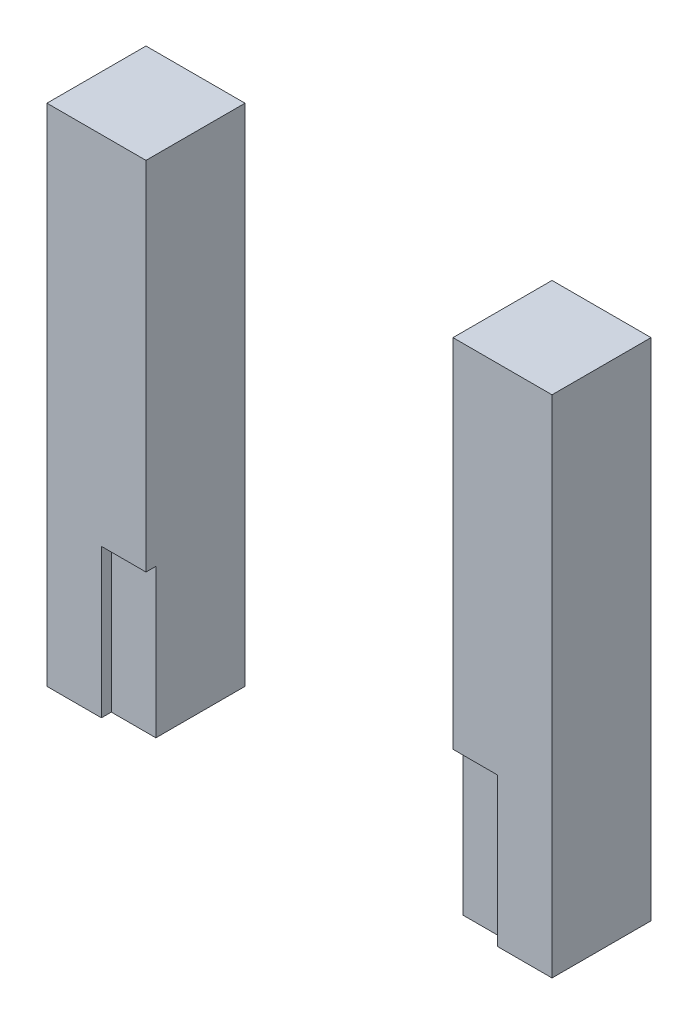
from build123d import *

# Parameters (mm, degrees)
SKETCH1_W           = 510
SKETCH1_H           = 510
SKETCH1_W_2         = 310
SKETCH1_H_2         = 310
BOSS_EXTRUDE1_DEPTH = 50
SKETCH2_W           = 400
SKETCH2_H           = 150
CUT_EXTRUDE1_DEPTH  = 10
SKETCH3_W           = 310
SKETCH3_H           = 100
CUT_EXTRUDE2_DEPTH  = 375.232548023


with BuildPart() as part:
    # Sketch1 → Boss-Extrude1 (new, symmetric)
    with BuildSketch(Plane.XY):
        Rectangle(SKETCH1_W, SKETCH1_H)
        Rectangle(SKETCH1_W_2, SKETCH1_H_2, mode=Mode.SUBTRACT)
    extrude(amount=BOSS_EXTRUDE1_DEPTH, both=True)

    # Sketch2 → Cut-Extrude1 (cut)
    with BuildSketch(Plane.XY.offset(50)):
        with Locations((0, -180)):
            Rectangle(SKETCH2_W, SKETCH2_H)
    extrude(amount=-CUT_EXTRUDE1_DEPTH, mode=Mode.SUBTRACT)

    # Sketch3 → Cut-Extrude2 (cut, through all)
    with BuildSketch(Plane(origin=(0, 0, -50), x_dir=(-1, 0, 0), z_dir=(0, 0, -1))):
        with Locations((0, -205)):
            Rectangle(SKETCH3_W, SKETCH3_H)
        with Locations((0, 205)):
            Rectangle(SKETCH3_W, SKETCH3_H)
    extrude(amount=-CUT_EXTRUDE2_DEPTH, mode=Mode.SUBTRACT)


with BuildPart() as cut_extrude2_piece_1:
    # of the separate pieces the step leaves, piece 1, a body of its own (cut_extrude2_pieces)
    add(part.part.solids().sort_by_distance((-255, 255, -50))[0])


with BuildPart() as cut_extrude2_piece_2:
    # of the separate pieces the step leaves, piece 2, a body of its own (cut_extrude2_pieces)
    add(part.part.solids().sort_by_distance((155, 255, -50))[0])


solid = Compound([cut_extrude2_piece_1.part, cut_extrude2_piece_2.part])
